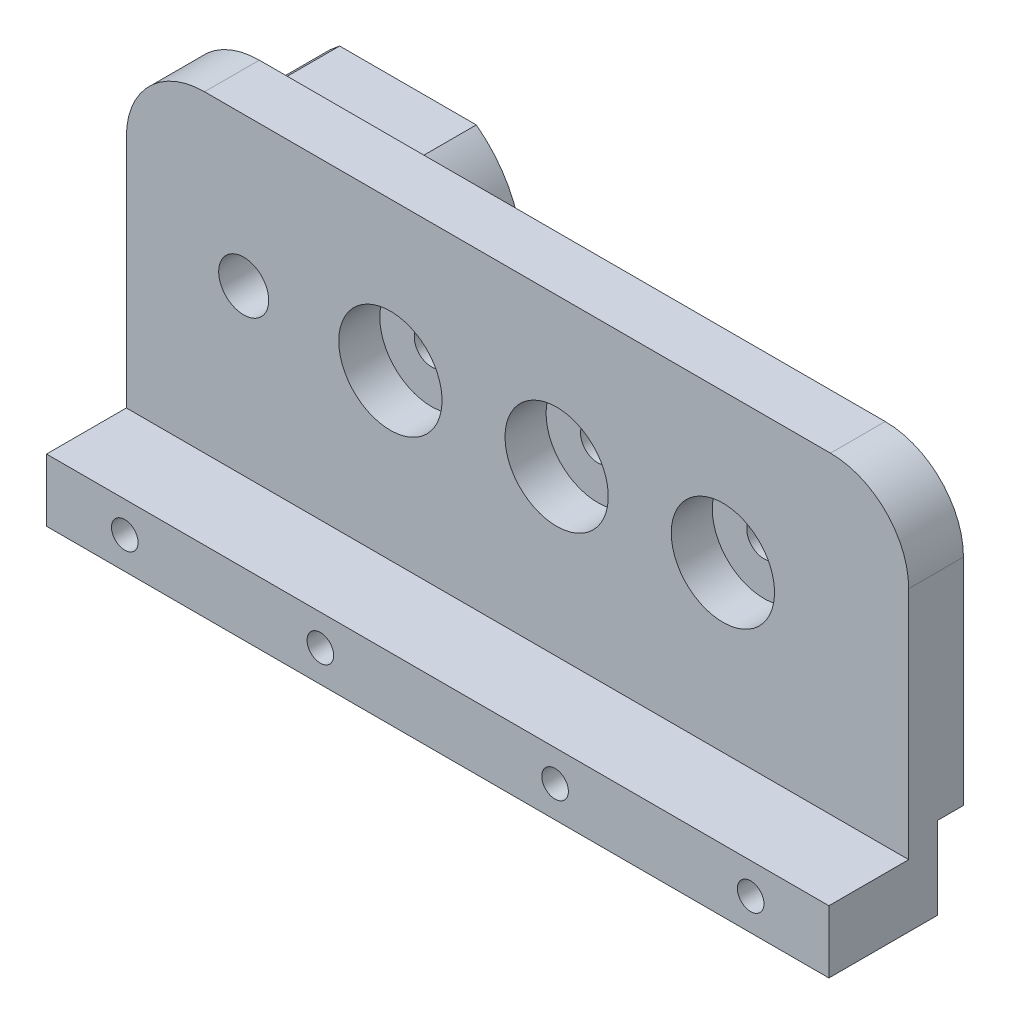
from build123d import *

# Parameters (mm, degrees)
SKETCH1_W           = 100
SKETCH1_H           = 48
BOSS_EXTRUDE1_DEPTH = 7
CUT_EXTRUDE1_REACH  = 113.144
SKETCH2_R           = 3.2
SKETCH2_R_2         = 2.2
SKETCH3_W           = 100
SKETCH3_H           = 8
BOSS_EXTRUDE2_DEPTH = 10.2
SKETCH4_R           = 6.6
CUT_EXTRUDE2_DEPTH  = 5.25
SKETCH5_R           = 2.6
CUT_EXTRUDE3_DEPTH  = 0.1
SKETCH7_R           = 1.7
CUT_EXTRUDE4_DEPTH  = 113.233729333
CUT_EXTRUDE5_REACH  = 114.249
SKETCH8_R           = 1.7
CUT_EXTRUDE6_REACH  = 116.257
SKETCH9_W           = 3.3
SKETCH9_H           = 10.5
BOSS_EXTRUDE3_DEPTH = 14
SHELL1_T            = 2.5
FILLET3_R           = 10


with BuildPart() as part:
    # Sketch1 → Boss-Extrude1 (new body)
    with BuildSketch(Plane.XY):
        with Locations((50, 24)):
            Rectangle(SKETCH1_W, SKETCH1_H)
    extrude(amount=BOSS_EXTRUDE1_DEPTH)

    # Sketch2 → Cut-Extrude1 (cut, up to next)
    with BuildSketch(Plane.XY.offset(7), mode=Mode.PRIVATE) as cut_extrude1_sk1:
        with Locations((15, 29)):
            Circle(SKETCH2_R)
    cut_extrude1_tool1 = extrude(cut_extrude1_sk1.sketch, amount=-CUT_EXTRUDE1_REACH, mode=Mode.PRIVATE) & part.part
    # Sketch2 → Cut-Extrude1 (cut, up to next)
    with BuildSketch(Plane.XY.offset(7), mode=Mode.PRIVATE) as cut_extrude1_sk2:
        with Locations((33.75, 29)):
            Circle(SKETCH2_R_2)
    cut_extrude1_tool2 = extrude(cut_extrude1_sk2.sketch, amount=-CUT_EXTRUDE1_REACH, mode=Mode.PRIVATE) & part.part
    # Sketch2 → Cut-Extrude1 (cut, up to next)
    with BuildSketch(Plane.XY.offset(7), mode=Mode.PRIVATE) as cut_extrude1_sk3:
        with Locations((55, 29)):
            Circle(SKETCH2_R_2)
    cut_extrude1_tool3 = extrude(cut_extrude1_sk3.sketch, amount=-CUT_EXTRUDE1_REACH, mode=Mode.PRIVATE) & part.part
    # Sketch2 → Cut-Extrude1 (cut, up to next)
    with BuildSketch(Plane.XY.offset(7), mode=Mode.PRIVATE) as cut_extrude1_sk4:
        with Locations((76.25, 29)):
            Circle(SKETCH2_R_2)
    cut_extrude1_tool4 = extrude(cut_extrude1_sk4.sketch, amount=-CUT_EXTRUDE1_REACH, mode=Mode.PRIVATE) & part.part
    add(cut_extrude1_tool1.solids().sort_by_distance((15, 29, 7))[0], mode=Mode.SUBTRACT)
    add(cut_extrude1_tool2.solids().sort_by_distance((33.75, 29, 7))[0], mode=Mode.SUBTRACT)
    add(cut_extrude1_tool3.solids().sort_by_distance((55, 29, 7))[0], mode=Mode.SUBTRACT)
    add(cut_extrude1_tool4.solids().sort_by_distance((76.25, 29, 7))[0], mode=Mode.SUBTRACT)

    # Sketch3 → Boss-Extrude2 (add)
    with BuildSketch(Plane(origin=(0, 0, 0), x_dir=(-1, 0, 0), z_dir=(0, 0, -1))):
        with Locations((-50, 4)):
            Rectangle(SKETCH3_W, SKETCH3_H)
    extrude(amount=BOSS_EXTRUDE2_DEPTH)

    # Sketch4 → Cut-Extrude2 (cut)
    with BuildSketch(Plane(origin=(0, 0, 0), x_dir=(-1, 0, 0), z_dir=(0, 0, -1))):
        with Locations((-76.25, 29)):
            Circle(SKETCH4_R)
        with Locations((-55, 29)):
            Circle(SKETCH4_R)
        with Locations((-33.75, 29)):
            Circle(SKETCH4_R)
    extrude(amount=-CUT_EXTRUDE2_DEPTH, mode=Mode.SUBTRACT)

    # Sketch5 → Cut-Extrude3 (cut)
    with BuildSketch(Plane.XY.offset(7)):
        with Locations((35.000022648, 4.052132501)):
            Circle(SKETCH5_R)
        with Locations((64.999977352, 4)):
            Circle(SKETCH5_R)
    extrude(amount=-CUT_EXTRUDE3_DEPTH, mode=Mode.SUBTRACT)

    # Sketch7 → Cut-Extrude4 (cut, through all)
    with BuildSketch(Plane.XY.offset(6.9)):
        with Locations((35.000022648, 4.052132501)):
            Circle(SKETCH7_R)
        with Locations((64.999977352, 4)):
            Circle(SKETCH7_R)
    extrude(amount=-CUT_EXTRUDE4_DEPTH, mode=Mode.SUBTRACT)

    # Sketch8 → Cut-Extrude5 (cut, up to next)
    with BuildSketch(Plane.XY.offset(7), mode=Mode.PRIVATE) as cut_extrude5_sk1:
        with Locations((10, 4.052132501)):
            Circle(SKETCH8_R)
    cut_extrude5_tool1 = extrude(cut_extrude5_sk1.sketch, amount=-CUT_EXTRUDE5_REACH, mode=Mode.PRIVATE) & part.part
    # Sketch8 → Cut-Extrude5 (cut, up to next)
    with BuildSketch(Plane.XY.offset(7), mode=Mode.PRIVATE) as cut_extrude5_sk2:
        with Locations((90, 4.052132501)):
            Circle(SKETCH8_R)
    cut_extrude5_tool2 = extrude(cut_extrude5_sk2.sketch, amount=-CUT_EXTRUDE5_REACH, mode=Mode.PRIVATE) & part.part
    add(cut_extrude5_tool1.solids().sort_by_distance((10, 4.052133, 7))[0], mode=Mode.SUBTRACT)
    add(cut_extrude5_tool2.solids().sort_by_distance((90, 4.052133, 7))[0], mode=Mode.SUBTRACT)


with BuildPart() as body_2:
    # Mirror1: mirrored copy
    add(part.part.mirror(Plane.XY.offset(-10.2)))

    # Sketch9 → Cut-Extrude6 (cut, up to next)
    with BuildSketch(Plane(origin=(100, 0, 0), x_dir=(0, 0, -1), z_dir=(1, 0, 0)), mode=Mode.PRIVATE) as cut_extrude6_sk1:
        with Locations((25.75, 5.25)):
            Rectangle(SKETCH9_W, SKETCH9_H)
    cut_extrude6_tool1 = extrude(cut_extrude6_sk1.sketch, amount=-CUT_EXTRUDE6_REACH, mode=Mode.PRIVATE) & body_2.part
    add(cut_extrude6_tool1.solids().sort_by_distance((100, 5.25, -25.75))[0], mode=Mode.SUBTRACT)


with BuildPart() as body_2_2:
    # Sketch10 → Boss-Extrude3 (new body)
    with BuildSketch(Plane(origin=(0, 0, -27.4), x_dir=(-1, 0, 0), z_dir=(0, 0, -1))):
        with BuildLine():
            Line((-7.140610711, 38.2), (-22.859389289, 38.2))
            ThreePointArc((-22.859389289, 38.2), (-27.1, 29), (-22.859389289, 19.8))
            Line((-22.859389289, 19.8), (-7.140610711, 19.8))
            ThreePointArc((-7.140610711, 19.8), (-2.9, 29), (-7.140610711, 38.2))
        make_face()
    extrude(amount=BOSS_EXTRUDE3_DEPTH)

    # Shell1
    shell1_openings = [body_2_2.faces().sort_by_distance(p)[0] for p in [
        (15, 29, -27.4),
        (15, 29, -41.4),
    ]]
    offset(amount=SHELL1_T, openings=shell1_openings, kind=Kind.INTERSECTION)


with BuildPart() as body_2_1:
    add(body_2.part)

    # Combine1: union body 2 2
    add(body_2_2.part)

    # Fillet3
    fillet3_edges = [body_2_1.edges().sort_by_distance(p)[0] for p in [
        (0, 48, -23.9),
        (100, 48, -23.9),
    ]]
    fillet(fillet3_edges, radius=FILLET3_R)


solid = body_2_1.part
